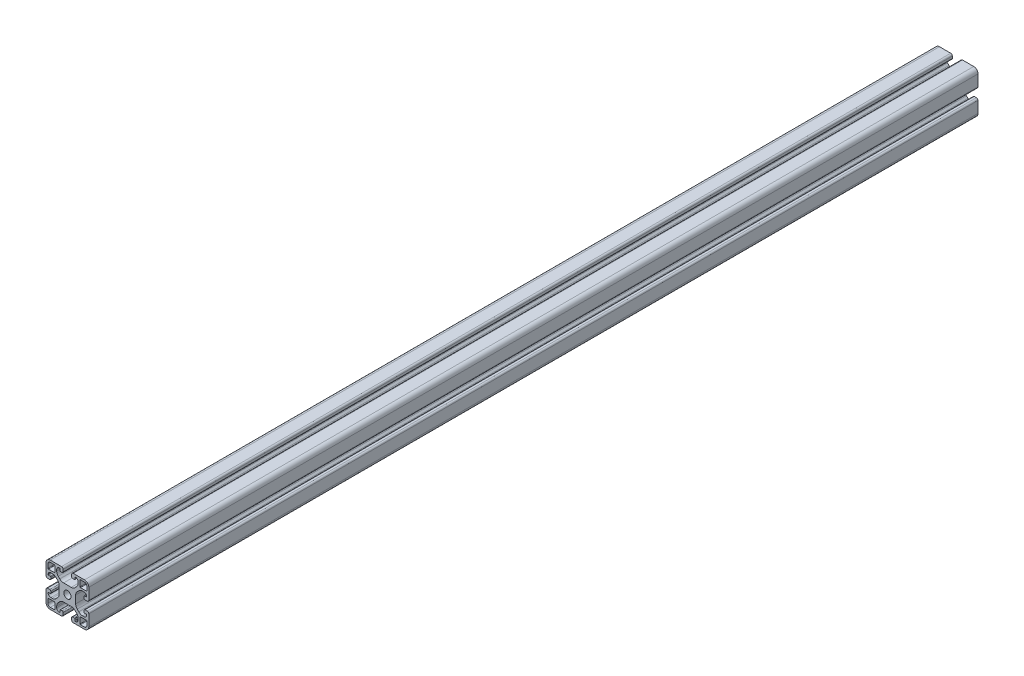
from build123d import *

# Parameters (mm, degrees)
ESQUISSE1_R        = 3.4
BOSS_EXTRU_1_DEPTH = 831.3


with BuildPart() as part:
    # Esquisse1 → Boss.-Extru.1 (new body)
    with BuildSketch(Plane(origin=(0, 0, -30), x_dir=(-1, 0, 0), z_dir=(0, 0, -1))):
        with BuildLine():
            Line((-4.5, 15), (-4.5, 13.5))
            ThreePointArc((-4.5, 13.5), (-4.353553391, 13.146446609), (-4, 13))
            Line((-4, 13), (-2.5, 13))
            ThreePointArc((-2.5, 13), (-2.146446609, 12.853553391), (-2, 12.5))
            ThreePointArc((-2, 12.5), (-2.732233047, 10.732233047), (-4.5, 10))
            Line((-4.5, 10), (-5.807611845, 10))
            ThreePointArc((-5.807611845, 10), (-7.721029006, 10.380602337), (-9.343145751, 11.464466094))
            Line((-9.343145751, 11.464466094), (-10.785533906, 12.906854249))
            ThreePointArc((-10.785533906, 12.906854249), (-11.869397663, 14.528970994), (-12.25, 16.442388155))
            Line((-12.25, 16.442388155), (-12.25, 23.557611845))
            ThreePointArc((-12.25, 23.557611845), (-11.869397663, 25.471029006), (-10.785533906, 27.093145751))
            Line((-10.785533906, 27.093145751), (-9.343145751, 28.535533906))
            ThreePointArc((-9.343145751, 28.535533906), (-7.721029006, 29.619397663), (-5.807611845, 30))
            Line((-5.807611845, 30), (-4.5, 30))
            ThreePointArc((-4.5, 30), (-2.732233047, 29.267766953), (-2, 27.5))
            ThreePointArc((-2, 27.5), (-2.146446609, 27.146446609), (-2.5, 27))
            Line((-2.5, 27), (-4, 27))
            ThreePointArc((-4, 27), (-4.353553391, 26.853553391), (-4.5, 26.5))
            Line((-4.5, 26.5), (-4.5, 25))
            ThreePointArc((-4.5, 25), (-4.207106781, 24.292893219), (-3.5, 24))
            Line((-3.5, 24), (-1.5, 24))
            ThreePointArc((-1.5, 24), (-0.439339828, 24.439339828), (0, 25.5))
            Line((0, 25.5), (0, 36))
            ThreePointArc((0, 36), (-1.171572875, 38.828427125), (-4, 40))
            Line((-4, 40), (-14.5, 40))
            ThreePointArc((-14.5, 40), (-15.560660172, 39.560660172), (-16, 38.5))
            Line((-16, 38.5), (-16, 36.5))
            ThreePointArc((-16, 36.5), (-15.707106781, 35.792893219), (-15, 35.5))
            Line((-15, 35.5), (-13.5, 35.5))
            ThreePointArc((-13.5, 35.5), (-13.146446609, 35.646446609), (-13, 36))
            Line((-13, 36), (-13, 37.5))
            ThreePointArc((-13, 37.5), (-12.853553391, 37.853553391), (-12.5, 38))
            ThreePointArc((-12.5, 38), (-10.732233047, 37.267766953), (-10, 35.5))
            Line((-10, 35.5), (-10, 34.192388155))
            ThreePointArc((-10, 34.192388155), (-10.380602337, 32.278970994), (-11.464466094, 30.656854249))
            Line((-11.464466094, 30.656854249), (-12.906854249, 29.214466094))
            ThreePointArc((-12.906854249, 29.214466094), (-14.528970994, 28.130602337), (-16.442388155, 27.75))
            Line((-16.442388155, 27.75), (-23.557611845, 27.75))
            ThreePointArc((-23.557611845, 27.75), (-25.471029006, 28.130602337), (-27.093145751, 29.214466094))
            Line((-27.093145751, 29.214466094), (-28.535533906, 30.656854249))
            ThreePointArc((-28.535533906, 30.656854249), (-29.619397663, 32.278970994), (-30, 34.192388155))
            Line((-30, 34.192388155), (-30, 35.5))
            ThreePointArc((-30, 35.5), (-29.267766953, 37.267766953), (-27.5, 38))
            ThreePointArc((-27.5, 38), (-27.146446609, 37.853553391), (-27, 37.5))
            Line((-27, 37.5), (-27, 36))
            ThreePointArc((-27, 36), (-26.853553391, 35.646446609), (-26.5, 35.5))
            Line((-26.5, 35.5), (-25, 35.5))
            ThreePointArc((-25, 35.5), (-24.292893219, 35.792893219), (-24, 36.5))
            Line((-24, 36.5), (-24, 38.5))
            ThreePointArc((-24, 38.5), (-24.439339828, 39.560660172), (-25.5, 40))
            Line((-25.5, 40), (-36, 40))
            ThreePointArc((-36, 40), (-38.828427125, 38.828427125), (-40, 36))
            Line((-40, 36), (-40, 25.5))
            ThreePointArc((-40, 25.5), (-39.560660172, 24.439339828), (-38.5, 24))
            Line((-38.5, 24), (-36.5, 24))
            ThreePointArc((-36.5, 24), (-35.792893219, 24.292893219), (-35.5, 25))
            Line((-35.5, 25), (-35.5, 26.5))
            ThreePointArc((-35.5, 26.5), (-35.646446609, 26.853553391), (-36, 27))
            Line((-36, 27), (-37.5, 27))
            ThreePointArc((-37.5, 27), (-37.853553391, 27.146446609), (-38, 27.5))
            ThreePointArc((-38, 27.5), (-37.267766953, 29.267766953), (-35.5, 30))
            Line((-35.5, 30), (-34.192388155, 30))
            ThreePointArc((-34.192388155, 30), (-32.278970994, 29.619397663), (-30.656854249, 28.535533906))
            Line((-30.656854249, 28.535533906), (-29.214466094, 27.093145751))
            ThreePointArc((-29.214466094, 27.093145751), (-28.130602337, 25.471029006), (-27.75, 23.557611845))
            Line((-27.75, 23.557611845), (-27.75, 16.442388155))
            ThreePointArc((-27.75, 16.442388155), (-28.130602337, 14.528970994), (-29.214466094, 12.906854249))
            Line((-29.214466094, 12.906854249), (-30.656854249, 11.464466094))
            ThreePointArc((-30.656854249, 11.464466094), (-32.278970994, 10.380602337), (-34.192388155, 10))
            Line((-34.192388155, 10), (-35.5, 10))
            ThreePointArc((-35.5, 10), (-37.267766953, 10.732233047), (-38, 12.5))
            ThreePointArc((-38, 12.5), (-37.853553391, 12.853553391), (-37.5, 13))
            Line((-37.5, 13), (-36, 13))
            ThreePointArc((-36, 13), (-35.646446609, 13.146446609), (-35.5, 13.5))
            Line((-35.5, 13.5), (-35.5, 15))
            ThreePointArc((-35.5, 15), (-35.792893219, 15.707106781), (-36.5, 16))
            Line((-36.5, 16), (-38.5, 16))
            ThreePointArc((-38.5, 16), (-39.560660172, 15.560660172), (-40, 14.5))
            Line((-40, 14.5), (-40, 4))
            ThreePointArc((-40, 4), (-38.828427125, 1.171572875), (-36, 0))
            Line((-36, 0), (-25.5, 0))
            ThreePointArc((-25.5, 0), (-24.439339828, 0.439339828), (-24, 1.5))
            Line((-24, 1.5), (-24, 3.5))
            ThreePointArc((-24, 3.5), (-24.292893219, 4.207106781), (-25, 4.5))
            Line((-25, 4.5), (-26.5, 4.5))
            ThreePointArc((-26.5, 4.5), (-26.853553391, 4.353553391), (-27, 4))
            Line((-27, 4), (-27, 2.5))
            ThreePointArc((-27, 2.5), (-27.146446609, 2.146446609), (-27.5, 2))
            ThreePointArc((-27.5, 2), (-29.267766953, 2.732233047), (-30, 4.5))
            Line((-30, 4.5), (-30, 5.807611845))
            ThreePointArc((-30, 5.807611845), (-29.619397663, 7.721029006), (-28.535533906, 9.343145751))
            Line((-28.535533906, 9.343145751), (-27.093145751, 10.785533906))
            ThreePointArc((-27.093145751, 10.785533906), (-25.471029006, 11.869397663), (-23.557611845, 12.25))
            Line((-23.557611845, 12.25), (-16.442388155, 12.25))
            ThreePointArc((-16.442388155, 12.25), (-14.528970994, 11.869397663), (-12.906854249, 10.785533906))
            Line((-12.906854249, 10.785533906), (-11.464466094, 9.343145751))
            ThreePointArc((-11.464466094, 9.343145751), (-10.380602337, 7.721029006), (-10, 5.807611845))
            Line((-10, 5.807611845), (-10, 4.5))
            ThreePointArc((-10, 4.5), (-10.732233047, 2.732233047), (-12.5, 2))
            ThreePointArc((-12.5, 2), (-12.853553391, 2.146446609), (-13, 2.5))
            Line((-13, 2.5), (-13, 4))
            ThreePointArc((-13, 4), (-13.146446609, 4.353553391), (-13.5, 4.5))
            Line((-13.5, 4.5), (-15, 4.5))
            ThreePointArc((-15, 4.5), (-15.707106781, 4.207106781), (-16, 3.5))
            Line((-16, 3.5), (-16, 1.5))
            ThreePointArc((-16, 1.5), (-15.560660172, 0.439339828), (-14.5, 0))
            Line((-14.5, 0), (-4, 0))
            ThreePointArc((-4, 0), (-1.171572875, 1.171572875), (0, 4))
            Line((0, 4), (0, 14.5))
            ThreePointArc((0, 14.5), (-0.439339828, 15.560660172), (-1.5, 16))
            Line((-1.5, 16), (-3.5, 16))
            ThreePointArc((-3.5, 16), (-4.207106781, 15.707106781), (-4.5, 15))
        make_face()
        with Locations(Location((-20, 20, 0), (0, 0, 180))):
            Circle(ESQUISSE1_R, mode=Mode.SUBTRACT)
        with BuildLine():
            Line((-4, 1.8), (-7.7, 1.8))
            ThreePointArc((-7.7, 1.8), (-8.053553391, 1.946446609), (-8.2, 2.3))
            Line((-8.2, 2.3), (-8.2, 7.7))
            ThreePointArc((-8.2, 7.7), (-8.053553391, 8.053553391), (-7.7, 8.2))
            Line((-7.7, 8.2), (-2.3, 8.2))
            ThreePointArc((-2.3, 8.2), (-1.946446609, 8.053553391), (-1.8, 7.7))
            Line((-1.8, 7.7), (-1.8, 4))
            ThreePointArc((-1.8, 4), (-2.444365081, 2.444365081), (-4, 1.8))
        make_face(mode=Mode.SUBTRACT)
        with BuildLine():
            Line((-38.2, 4), (-38.2, 7.7))
            ThreePointArc((-38.2, 7.7), (-38.053553391, 8.053553391), (-37.7, 8.2))
            Line((-37.7, 8.2), (-32.3, 8.2))
            ThreePointArc((-32.3, 8.2), (-31.946446609, 8.053553391), (-31.8, 7.7))
            Line((-31.8, 7.7), (-31.8, 2.3))
            ThreePointArc((-31.8, 2.3), (-31.946446609, 1.946446609), (-32.3, 1.8))
            Line((-32.3, 1.8), (-36, 1.8))
            ThreePointArc((-36, 1.8), (-37.555634919, 2.444365081), (-38.2, 4))
        make_face(mode=Mode.SUBTRACT)
        with BuildLine():
            Line((-36, 38.2), (-32.3, 38.2))
            ThreePointArc((-32.3, 38.2), (-31.946446609, 38.053553391), (-31.8, 37.7))
            Line((-31.8, 37.7), (-31.8, 32.3))
            ThreePointArc((-31.8, 32.3), (-31.946446609, 31.946446609), (-32.3, 31.8))
            Line((-32.3, 31.8), (-37.7, 31.8))
            ThreePointArc((-37.7, 31.8), (-38.053553391, 31.946446609), (-38.2, 32.3))
            Line((-38.2, 32.3), (-38.2, 36))
            ThreePointArc((-38.2, 36), (-37.555634919, 37.555634919), (-36, 38.2))
        make_face(mode=Mode.SUBTRACT)
        with BuildLine():
            Line((-1.8, 36), (-1.8, 32.3))
            ThreePointArc((-1.8, 32.3), (-1.946446609, 31.946446609), (-2.3, 31.8))
            Line((-2.3, 31.8), (-7.7, 31.8))
            ThreePointArc((-7.7, 31.8), (-8.053553391, 31.946446609), (-8.2, 32.3))
            Line((-8.2, 32.3), (-8.2, 37.7))
            ThreePointArc((-8.2, 37.7), (-8.053553391, 38.053553391), (-7.7, 38.2))
            Line((-7.7, 38.2), (-4, 38.2))
            ThreePointArc((-4, 38.2), (-2.444365081, 37.555634919), (-1.8, 36))
        make_face(mode=Mode.SUBTRACT)
    extrude(amount=-BOSS_EXTRU_1_DEPTH)


solid = part.part
